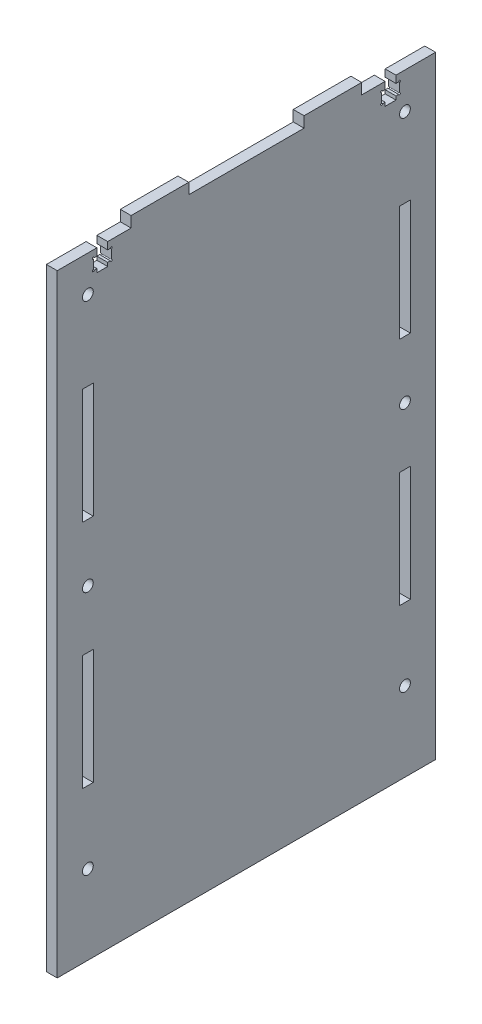
from build123d import *

# Parameters (mm, degrees)
CROQUIS1_W              = 105
CROQUIS1_H              = 170
CROQUIS1_R              = 1.5
CROQUIS1_W_2            = 3
CROQUIS1_H_2            = 32
SALIENTE_EXTRUIR1_DEPTH = 3
CROQUIS2_W              = 3
CROQUIS2_H              = 16
SALIENTE_EXTRUIR2_DEPTH = 3
CORTAR_EXTRUIR1_DEPTH   = 3


with BuildPart() as part:
    # Croquis1 → Saliente-Extruir1 (new body)
    with BuildSketch(Plane(origin=(0, 0, 0), x_dir=(0, 0, -1), z_dir=(1, 0, 0))):
        with Locations((52.5, 85)):
            Rectangle(CROQUIS1_W, CROQUIS1_H)
        with Locations((96.5, 160)):
            Circle(CROQUIS1_R, mode=Mode.SUBTRACT)
        with Locations((96.5, 22)):
            Circle(CROQUIS1_R, mode=Mode.SUBTRACT)
        with Locations((96.5, 90)):
            Circle(CROQUIS1_R, mode=Mode.SUBTRACT)
        with Locations(Location((8.5, 22, 0), (0, 0, 180))):
            Circle(CROQUIS1_R, mode=Mode.SUBTRACT)
        with Locations(Location((8.5, 90, 0), (0, 0, 180))):
            Circle(CROQUIS1_R, mode=Mode.SUBTRACT)
        with Locations(Location((8.5, 160, 0), (0, 0, 180))):
            Circle(CROQUIS1_R, mode=Mode.SUBTRACT)
        with Locations((96.5, 58)):
            Rectangle(CROQUIS1_W_2, CROQUIS1_H_2, mode=Mode.SUBTRACT)
        with Locations((96.5, 122)):
            Rectangle(CROQUIS1_W_2, CROQUIS1_H_2, mode=Mode.SUBTRACT)
        with Locations((8.5, 58)):
            Rectangle(CROQUIS1_W_2, CROQUIS1_H_2, mode=Mode.SUBTRACT)
        with Locations((8.5, 122)):
            Rectangle(CROQUIS1_W_2, CROQUIS1_H_2, mode=Mode.SUBTRACT)
    extrude(amount=SALIENTE_EXTRUIR1_DEPTH)

    # Croquis2 → Saliente-Extruir2 (add)
    with BuildSketch(Plane(origin=(0, 170, 0), x_dir=(1, 0, 0), z_dir=(0, 1, 0))):
        with Locations((1.5, 76.5)):
            Rectangle(CROQUIS2_W, CROQUIS2_H)
        with Locations((1.5, 28.5)):
            Rectangle(CROQUIS2_W, CROQUIS2_H)
    extrude(amount=SALIENTE_EXTRUIR2_DEPTH)

    # Croquis3 → Cortar-Extruir1 (cut)
    with BuildSketch(Plane.ZY):
        with BuildLine():
            Line((-11, 168), (-11, 170))
            Line((-11, 170), (-14, 170))
            Line((-14, 170), (-14, 168))
            Line((-14, 168), (-14.75, 168))
            ThreePointArc((-14.75, 168), (-15.176776695, 168.176776695), (-15, 167.75))
            Line((-15, 167.75), (-15, 165.25))
            ThreePointArc((-15, 165.25), (-15.176776695, 164.823223305), (-14.75, 165))
            Line((-14.75, 165), (-14, 165))
            Line((-14, 165), (-14, 164))
            Line((-14, 164), (-11, 164))
            Line((-11, 164), (-11, 165))
            Line((-11, 165), (-10.25, 165))
            ThreePointArc((-10.25, 165), (-9.823223305, 164.823223305), (-10, 165.25))
            Line((-10, 165.25), (-10, 167.75))
            ThreePointArc((-10, 167.75), (-9.823223305, 168.176776695), (-10.25, 168))
            Line((-10.25, 168), (-11, 168))
        make_face()
        with BuildLine():
            Line((-91, 168), (-91, 170))
            Line((-91, 170), (-94, 170))
            Line((-94, 170), (-94, 168))
            Line((-94, 168), (-94.75, 168))
            ThreePointArc((-94.75, 168), (-95.176776695, 168.176776695), (-95, 167.75))
            Line((-95, 167.75), (-95, 165.25))
            ThreePointArc((-95, 165.25), (-95.176776695, 164.823223305), (-94.75, 165))
            Line((-94.75, 165), (-94, 165))
            Line((-94, 165), (-94, 164))
            Line((-94, 164), (-91, 164))
            Line((-91, 164), (-91, 165))
            Line((-91, 165), (-90.25, 165))
            ThreePointArc((-90.25, 165), (-89.823223305, 164.823223305), (-90, 165.25))
            Line((-90, 165.25), (-90, 167.75))
            ThreePointArc((-90, 167.75), (-89.823223305, 168.176776695), (-90.25, 168))
            Line((-90.25, 168), (-91, 168))
        make_face()
    extrude(amount=-CORTAR_EXTRUIR1_DEPTH, mode=Mode.SUBTRACT)


solid = part.part
